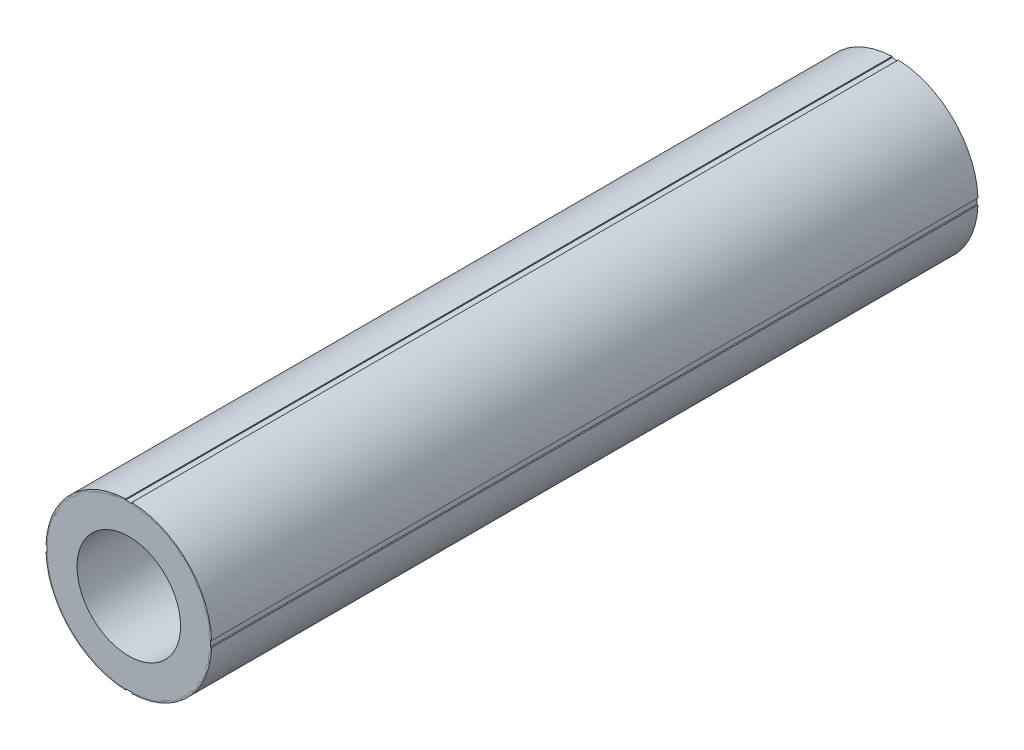
from build123d import *

# Parameters (mm, degrees)
SKETCH1_R                = 0.4
SKETCH1_R_2              = 0.39
EXTERNAL_ELECTRODE_DEPTH = 3.7
SKETCH3_W                = 0.03
SKETCH3_H                = 1
SKETCH3_W_2              = 1
SKETCH3_H_2              = 0.03
CUTS_DEPTH               = 3.7
SKETCH5_R                = 0.395
SKETCH5_R_2              = 0.255
PZT_TUBE_DEPTH           = 3.7
SKETCH7_R                = 0.255
SKETCH7_R_2              = 0.25
INTERNAL_ELECTRODE_DEPTH = 3.7


with BuildPart() as part:
    # Sketch1 → External Electrode (new body)
    with BuildSketch(Plane.XY):
        Circle(SKETCH1_R)
        Circle(SKETCH1_R_2, mode=Mode.SUBTRACT)
    extrude(amount=EXTERNAL_ELECTRODE_DEPTH)

    # Sketch3 → Cuts (cut)
    with BuildSketch(Plane.XY):
        Rectangle(SKETCH3_W, SKETCH3_H)
        Rectangle(SKETCH3_W_2, SKETCH3_H_2)
    extrude(amount=CUTS_DEPTH, mode=Mode.SUBTRACT)


with BuildPart() as cuts_piece_1:
    # of the separate pieces the step leaves, piece 1, a body of its own (cuts_pieces)
    add(part.part.solids().sort_by_distance((-0.015, 0.399718651, 0))[0])


with BuildPart() as cuts_piece_2:
    # of the separate pieces the step leaves, piece 2, a body of its own (cuts_pieces)
    add(part.part.solids().sort_by_distance((-0.399718651, -0.015, 0))[0])


with BuildPart() as cuts_piece_3:
    # of the separate pieces the step leaves, piece 3, a body of its own (cuts_pieces)
    add(part.part.solids().sort_by_distance((0.015, -0.399718651, 0))[0])


with BuildPart() as cuts_piece_4:
    # of the separate pieces the step leaves, piece 4, a body of its own (cuts_pieces)
    add(part.part.solids().sort_by_distance((0.399718651, 0.015, 0))[0])


with BuildPart() as body_5:
    # Sketch5 → PZT Tube (new body)
    with BuildSketch(Plane.XY):
        Circle(SKETCH5_R)
        Circle(SKETCH5_R_2, mode=Mode.SUBTRACT)
    extrude(amount=PZT_TUBE_DEPTH)

    # Sketch7 → Internal Electrode (add)
    with BuildSketch(Plane.XY.offset(3.7)):
        Circle(SKETCH7_R)
        Circle(SKETCH7_R_2, mode=Mode.SUBTRACT)
    extrude(amount=-INTERNAL_ELECTRODE_DEPTH)


solid = Compound([cuts_piece_1.part, cuts_piece_2.part, cuts_piece_3.part, cuts_piece_4.part, body_5.part])
